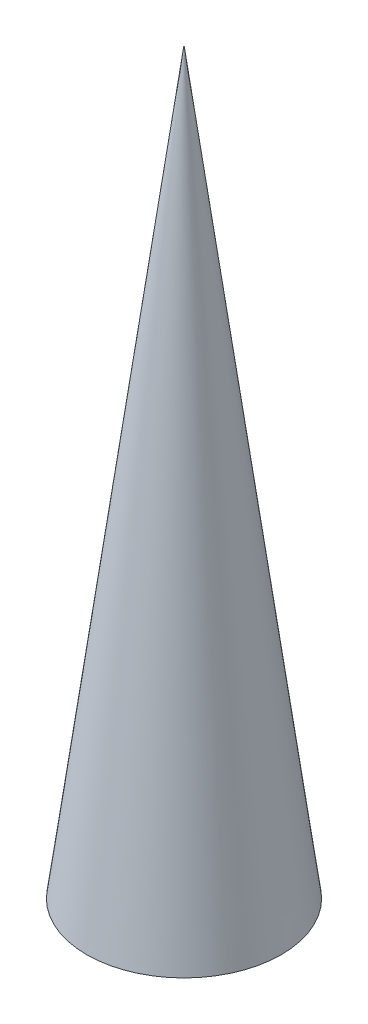
from build123d import *


with BuildPart() as part:
    # 草图1 one side → 旋转3 (revolve)
    with BuildSketch(Plane.XY):
        Polygon((142.550767116, -1082.780575595), (0.209108653, -1.588337915), (0, -1.588337915), (0, -1082.780575595), align=None)
    revolve(axis=Axis((0, -1.588337915, 0), (0, -1, 0)))


solid = part.part
